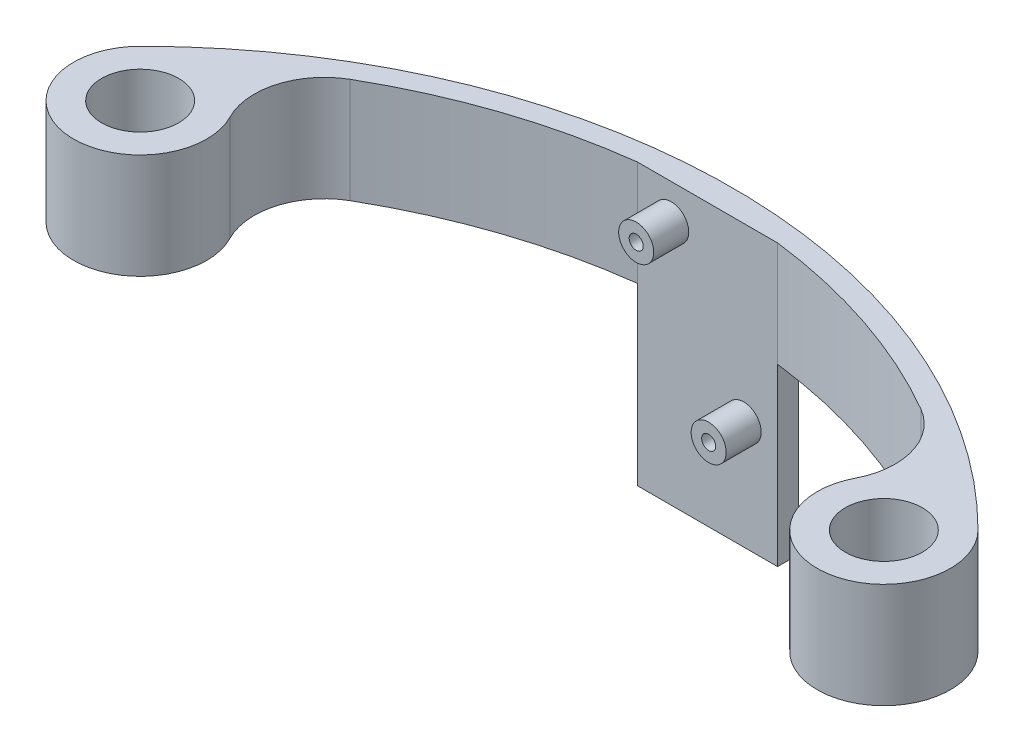
from build123d import *

# Parameters (mm, degrees)
SKETCH1_W           = 20
SKETCH1_H           = 40
BOSS_EXTRUDE1_DEPTH = 3
SKETCH2_R           = 2.5
SKETCH2_R_2         = 1
BOSS_EXTRUDE2_DEPTH = 5
SKETCH3_R           = 5.5
BOSS_EXTRUDE3_DEPTH = 15


with BuildPart() as part:
    # Sketch1 → Boss-Extrude1 (new body)
    with BuildSketch(Plane.XY):
        with Locations((10, -20)):
            Rectangle(SKETCH1_W, SKETCH1_H)
    extrude(amount=BOSS_EXTRUDE1_DEPTH)

    # Sketch2 → Boss-Extrude2 (add)
    # profile 1 of 2: a face of its own
    with BuildSketch(Plane.XY.offset(3)):
        with Locations((4.83, -5)):
            Circle(SKETCH2_R)
        with Locations((4.83, -5)):
            Circle(SKETCH2_R_2, mode=Mode.SUBTRACT)
    # profile 2 of 2: a face of its own
    with BuildSketch(Plane.XY.offset(3)):
        with Locations((15.1678, -24.558)):
            Circle(SKETCH2_R)
        with Locations((15.1678, -24.558)):
            Circle(SKETCH2_R_2, mode=Mode.SUBTRACT)
    extrude(amount=BOSS_EXTRUDE2_DEPTH)

    # Sketch3 → Boss-Extrude3 (add)
    # profile 1 of 3: a face of its own
    with BuildSketch(Plane(origin=(0, 0, 0), x_dir=(1, 0, 0), z_dir=(0, 1, 0))):
        with BuildLine():
            Line((0, -3), (0, 0))
            ThreePointArc((0, 0), (-26.919603607, -7.898350205), (-49.769666667, -24.174824407))
            ThreePointArc((-49.769666667, -24.174824407), (-44.509522467, -40.277400292), (-34.608629413, -26.532059851))
            ThreePointArc((-34.608629413, -26.532059851), (-35.317872875, -19.127120719), (-30.717669917, -13.28124332))
            ThreePointArc((-30.717669917, -13.28124332), (-15.874630461, -6.599559407), (0, -3))
        make_face()
        with Locations(Location((-43.05, -30.890185893, 0), (0, 0, 270))):
            Circle(SKETCH3_R, mode=Mode.SUBTRACT)
    # profile 2 of 3: a face of its own
    with BuildSketch(Plane(origin=(0, 0, 0), x_dir=(1, 0, 0), z_dir=(0, 1, 0))):
        with BuildLine():
            ThreePointArc((69.769666667, -24.174824407), (46.919603607, -7.898350205), (20, 0))
            Line((20, 0), (20, -3))
            ThreePointArc((20, -3), (35.874630461, -6.599559407), (50.717669917, -13.28124332))
            ThreePointArc((50.717669917, -13.28124332), (55.317872875, -19.127120719), (54.608629413, -26.532059851))
            ThreePointArc((54.608629413, -26.532059851), (64.509522467, -40.277400292), (69.769666667, -24.174824407))
        make_face()
        with Locations(Location((63.05, -30.890185893, 0), (0, 0, 270))):
            Circle(SKETCH3_R, mode=Mode.SUBTRACT)
    # profile 3 of 3: a face of its own
    with BuildSketch(Plane(origin=(0, 0, 0), x_dir=(1, 0, 0), z_dir=(0, 1, 0))):
        with BuildLine():
            Line((0, 0), (20, 0))
            ThreePointArc((20, 0), (10, 0.593802374), (0, 0))
        make_face()
    extrude(amount=-BOSS_EXTRUDE3_DEPTH)


solid = part.part
